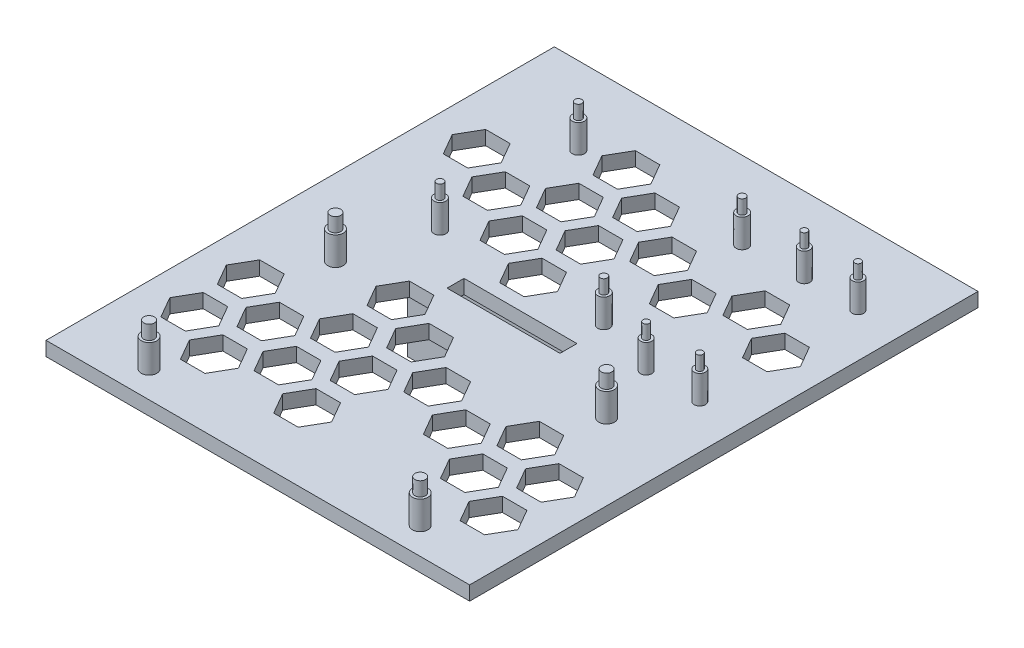
from build123d import *

# Parameters (mm, degrees)
ESQUISSE1_W                     = 62
ESQUISSE1_H                     = 12
ESQUISSE1_W_2                   = 58
ESQUISSE1_H_2                   = 8
BOSS_EXTRU_1_DEPTH              = 20
ESQUISSE2_R                     = 3.175
ENL_V_MAT_EXTRU_1_DEPTH         = 39.794329483
ESQUISSE3_W                     = 150
ESQUISSE3_H                     = 180
BOSS_EXTRU_2_DEPTH              = 5
ENL_V_MAT_EXTRU_3_REACH         = 120.849
ESQUISSE6_W                     = 40
ESQUISSE6_H                     = 6
ESQUISSE11_R                    = 2.75
BOSS_EXTRU_3_DEPTH              = 10
ESQUISSE13_R                    = 2
BOSS_EXTRU_4_DEPTH              = 10
ESQUISSE12_R                    = 2.125
BOSS_EXTRU_5_DEPTH              = 10
ESQUISSE10_R                    = 1.875
BOSS_EXTRU_6_DEPTH              = 15
ESQUISSE9_R                     = 1.125
BOSS_EXTRU_7_DEPTH              = 15
ESQUISSE8_R                     = 1.25
BOSS_EXTRU_8_DEPTH              = 15
ENL_V_MAT_EXTRU_4_DEPTH         = 120.791485507
R_P_TITION_LIN_AIRE1_COUNT      = 7
R_P_TITION_LIN_AIRE1_PITCH      = 20
R_P_TITION_LIN_AIRE1_COUNT_DIR2 = 4
R_P_TITION_LIN_AIRE1_PITCH_DIR2 = 33


with BuildPart() as part:
    # Esquisse1 → Boss.-Extru.1 (new body)
    with BuildSketch(Plane(origin=(0, 0, 0), x_dir=(1, 0, 0), z_dir=(0, 1, 0))):
        Rectangle(ESQUISSE1_W, ESQUISSE1_H)
        Rectangle(ESQUISSE1_W_2, ESQUISSE1_H_2, mode=Mode.SUBTRACT)
    extrude(amount=BOSS_EXTRU_1_DEPTH)

    # Esquisse2 → Enlèv. mat.-Extru.1 (cut, through all)
    with BuildSketch(Plane.XY.offset(6)):
        with Locations((0, 8)):
            Circle(ESQUISSE2_R)
    extrude(amount=-ENL_V_MAT_EXTRU_1_DEPTH, mode=Mode.SUBTRACT)

    # Esquisse3 → Boss.-Extru.2 (add)
    with BuildSketch(Plane(origin=(0, 20, 0), x_dir=(1, 0, 0), z_dir=(0, 1, 0))):
        Rectangle(ESQUISSE3_W, ESQUISSE3_H)
    extrude(amount=BOSS_EXTRU_2_DEPTH)

    # Esquisse6 → Enlèv. mat.-Extru.3 (cut, up to next)
    with BuildSketch(Plane(origin=(0, 20, 0), x_dir=(-1, 0, 0), z_dir=(0, -1, 0)), mode=Mode.PRIVATE) as enl_v_mat_extru_3_sk1:
        Rectangle(ESQUISSE6_W, ESQUISSE6_H)
    enl_v_mat_extru_3_tool1 = extrude(enl_v_mat_extru_3_sk1.sketch, amount=-ENL_V_MAT_EXTRU_3_REACH, mode=Mode.PRIVATE) & part.part
    add(enl_v_mat_extru_3_tool1.solids().sort_by_distance((0, 20, 0))[0], mode=Mode.SUBTRACT)

    # Esquisse11 → Boss.-Extru.3 (add)
    with BuildSketch(Plane(origin=(0, 25, 0), x_dir=(1, 0, 0), z_dir=(0, 1, 0))):
        with Locations(Location((-48, -14.5, 0), (0, 0, 270))):
            Circle(ESQUISSE11_R)
        with Locations(Location((-48, -80.5, 0), (0, 0, 270))):
            Circle(ESQUISSE11_R)
        with Locations(Location((48, -14.5, 0), (0, 0, 270))):
            Circle(ESQUISSE11_R)
        with Locations(Location((48, -80.5, 0), (0, 0, 270))):
            Circle(ESQUISSE11_R)
    extrude(amount=BOSS_EXTRU_3_DEPTH)

    # Esquisse13 → Boss.-Extru.4 (add)
    with BuildSketch(Plane(origin=(0, 25, 0), x_dir=(1, 0, 0), z_dir=(0, 1, 0))):
        with Locations(Location((59.5, 7, 0), (0, 0, 270))):
            Circle(ESQUISSE13_R)
        with Locations(Location((59.5, 63, 0), (0, 0, 270))):
            Circle(ESQUISSE13_R)
        with Locations(Location((40.5, 7, 0), (0, 0, 270))):
            Circle(ESQUISSE13_R)
        with Locations(Location((40.5, 63, 0), (0, 0, 270))):
            Circle(ESQUISSE13_R)
    extrude(amount=BOSS_EXTRU_4_DEPTH)

    # Esquisse12 → Boss.-Extru.5 (add)
    with BuildSketch(Plane(origin=(0, 25, 0), x_dir=(1, 0, 0), z_dir=(0, 1, 0))):
        with Locations(Location((19, 62.5, 0), (0, 0, 270))):
            Circle(ESQUISSE12_R)
        with Locations(Location((19, 13.5, 0), (0, 0, 270))):
            Circle(ESQUISSE12_R)
        with Locations(Location((-39, 62.5, 0), (0, 0, 270))):
            Circle(ESQUISSE12_R)
        with Locations(Location((-39, 13.5, 0), (0, 0, 270))):
            Circle(ESQUISSE12_R)
    extrude(amount=BOSS_EXTRU_5_DEPTH)

    # Esquisse10 → Boss.-Extru.6 (add)
    with BuildSketch(Plane(origin=(0, 25, 0), x_dir=(1, 0, 0), z_dir=(0, 1, 0))):
        with Locations(Location((-48, -14.5, 0), (0, 0, 270))):
            Circle(ESQUISSE10_R)
        with Locations(Location((48, -14.5, 0), (0, 0, 270))):
            Circle(ESQUISSE10_R)
        with Locations(Location((-48, -80.5, 0), (0, 0, 270))):
            Circle(ESQUISSE10_R)
        with Locations(Location((48, -80.5, 0), (0, 0, 270))):
            Circle(ESQUISSE10_R)
    extrude(amount=BOSS_EXTRU_6_DEPTH)

    # Esquisse9 → Boss.-Extru.7 (add)
    with BuildSketch(Plane(origin=(0, 25, 0), x_dir=(1, 0, 0), z_dir=(0, 1, 0))):
        with Locations(Location((59.5, 63, 0), (0, 0, 270))):
            Circle(ESQUISSE9_R)
        with Locations(Location((40.5, 63, 0), (0, 0, 270))):
            Circle(ESQUISSE9_R)
        with Locations(Location((59.5, 7, 0), (0, 0, 270))):
            Circle(ESQUISSE9_R)
        with Locations(Location((40.5, 7, 0), (0, 0, 270))):
            Circle(ESQUISSE9_R)
    extrude(amount=BOSS_EXTRU_7_DEPTH)

    # Esquisse8 → Boss.-Extru.8 (add)
    with BuildSketch(Plane(origin=(0, 25, 0), x_dir=(1, 0, 0), z_dir=(0, 1, 0))):
        with Locations(Location((19, 62.5, 0), (0, 0, 270))):
            Circle(ESQUISSE8_R)
        with Locations(Location((19, 13.5, 0), (0, 0, 270))):
            Circle(ESQUISSE8_R)
        with Locations(Location((-39, 62.5, 0), (0, 0, 270))):
            Circle(ESQUISSE8_R)
        with Locations(Location((-39, 13.5, 0), (0, 0, 270))):
            Circle(ESQUISSE8_R)
    extrude(amount=BOSS_EXTRU_8_DEPTH)

    # Esquisse14 → Enlèv. mat.-Extru.4 (cut, through all)
    with BuildSketch(Plane(origin=(0, 25, 0), x_dir=(1, 0, 0), z_dir=(0, 1, 0))):
        Polygon((-53.169872981, -62.5), (-48.839745962, -55), (-53.169872981, -47.5), (-61.830127019, -47.5), (-66.160254038, -55), (-61.830127019, -62.5), align=None)
        Polygon((-36.715390309, -72), (-32.38526329, -64.5), (-36.715390309, -57), (-45.375644347, -57), (-49.705771366, -64.5), (-45.375644347, -72), align=None)
    enl_v_mat_extru_4 = extrude(amount=-ENL_V_MAT_EXTRU_4_DEPTH, mode=Mode.SUBTRACT)

    # Répétition linéaire1: Enl_v. mat.-Extru.4 7 × 4, 14 skipped
    with Locations(*[(j * R_P_TITION_LIN_AIRE1_PITCH_DIR2, 0, -i * R_P_TITION_LIN_AIRE1_PITCH) for i in range(R_P_TITION_LIN_AIRE1_COUNT) for j in range(R_P_TITION_LIN_AIRE1_COUNT_DIR2) if (i, j) not in ((0, 0), (0, 2), (2, 0), (2, 2), (2, 3), (3, 0), (3, 1), (3, 2), (3, 3), (4, 0), (4, 2), (4, 3), (6, 0), (6, 2), (6, 3))]):
        add(enl_v_mat_extru_4, mode=Mode.SUBTRACT)


solid = part.part
